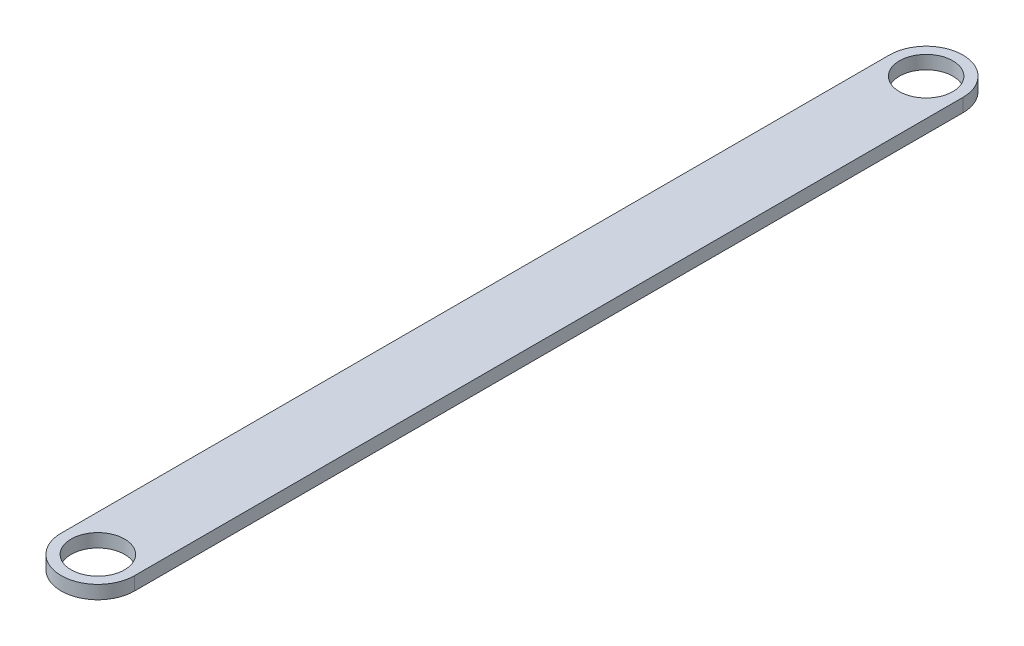
from build123d import *

# Parameters (mm, degrees)
SKETCH1_R           = 4
BOSS_EXTRUDE1_DEPTH = 2


with BuildPart() as part:
    # Sketch1 → Boss-Extrude1 (new body)
    with BuildSketch(Plane(origin=(0, 0, 0), x_dir=(1, 0, 0), z_dir=(0, 1, 0))):
        with BuildLine():
            Line((-5.5, 0), (-5.5, 124))
            ThreePointArc((-5.5, 124), (0, 129.5), (5.5, 124))
            Line((5.5, 124), (5.5, 0))
            ThreePointArc((5.5, 0), (0, -5.5), (-5.5, 0))
        make_face()
        with Locations(Location((0, 124, 0), (0, 0, 270))):
            Circle(SKETCH1_R, mode=Mode.SUBTRACT)
        with Locations(Location((0, 0, 0), (0, 0, 270))):
            Circle(SKETCH1_R, mode=Mode.SUBTRACT)
    extrude(amount=BOSS_EXTRUDE1_DEPTH)


solid = part.part
